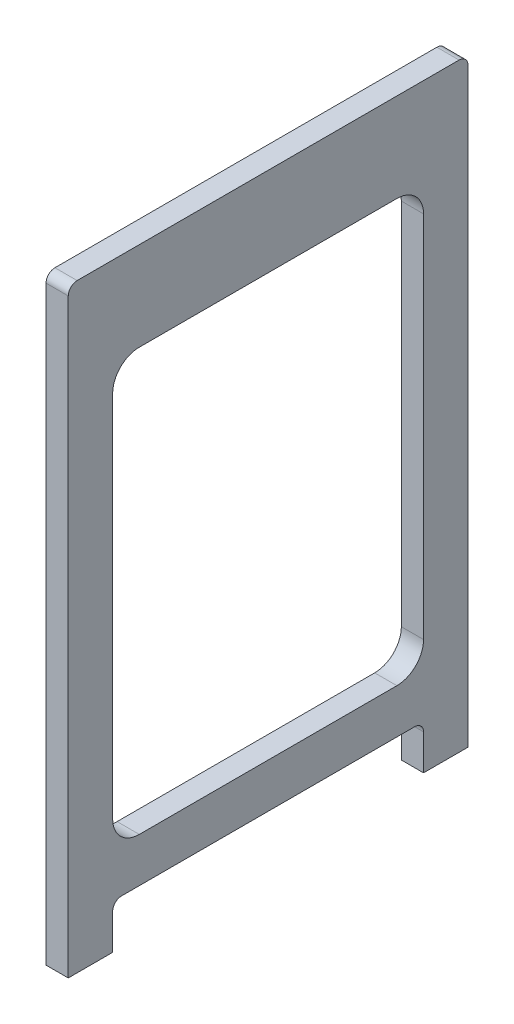
from build123d import *

# Parameters (mm, degrees)
SKETCH1_R           = 2.5
SKETCH1_W           = 350
SKETCH1_H           = 475
BOSS_EXTRUDE1_DEPTH = 12.5
BOSS_EXTRUDE2_START = -15
SKETCH2_R           = 2.5
BOSS_EXTRUDE2_DEPTH = 15
FILLET1_R           = 10
FILLET2_R           = 30
FILLET3_R           = 10


with BuildPart() as part:
    # Sketch1 → Boss-Extrude1 (new, symmetric)
    with BuildSketch(Plane(origin=(0, 0, 0), x_dir=(0, 0, -1), z_dir=(1, 0, 0))):
        Polygon((-175, -337.5), (-225, -337.5), (-225, 337.5), (225, 337.5), (225, -337.5), (175, -337.5), (175, -287.5), (-175, -287.5), align=None)
        with Locations((-150, 330)):
            Circle(SKETCH1_R, mode=Mode.SUBTRACT)
        with Locations((-110, 330)):
            Circle(SKETCH1_R, mode=Mode.SUBTRACT)
        with Locations((-130, 315)):
            Circle(SKETCH1_R, mode=Mode.SUBTRACT)
        with Locations(Location((110, 330, 0), (0, 0, 180))):
            Circle(SKETCH1_R, mode=Mode.SUBTRACT)
        with Locations(Location((150, 330, 0), (0, 0, 180))):
            Circle(SKETCH1_R, mode=Mode.SUBTRACT)
        with Locations(Location((130, 315, 0), (0, 0, 180))):
            Circle(SKETCH1_R, mode=Mode.SUBTRACT)
        Rectangle(SKETCH1_W, SKETCH1_H, mode=Mode.SUBTRACT)
    extrude(amount=BOSS_EXTRUDE1_DEPTH, both=True)

    # Sketch2 → Boss-Extrude2 (add)
    with BuildSketch(Plane(origin=(12.5, 0, 0), x_dir=(0, 0, -1), z_dir=(1, 0, 0)).offset(BOSS_EXTRUDE2_START)):
        with Locations((-110, 330)):
            Circle(SKETCH2_R)
        with Locations((-130, 315)):
            Circle(SKETCH2_R)
        with Locations((-150, 330)):
            Circle(SKETCH2_R)
        with Locations(Location((150, 330, 0), (0, 0, 180))):
            Circle(SKETCH2_R)
        with Locations(Location((130, 315, 0), (0, 0, 180))):
            Circle(SKETCH2_R)
        with Locations(Location((110, 330, 0), (0, 0, 180))):
            Circle(SKETCH2_R)
    extrude(amount=BOSS_EXTRUDE2_DEPTH)

    # Fillet1
    fillet1_edges = [part.edges().sort_by_distance(p)[0] for p in [
        (0, -287.5, -175),
        (0, -287.5, 175),
    ]]
    fillet(fillet1_edges, radius=FILLET1_R)

    # Fillet2
    fillet2_edges = [part.edges().sort_by_distance(p)[0] for p in [
        (0, 237.5, 175),
        (0, -237.5, 175),
        (0, -237.5, -175),
        (0, 237.5, -175),
    ]]
    fillet(fillet2_edges, radius=FILLET2_R)

    # Fillet3
    fillet3_edges = [part.edges().sort_by_distance(p)[0] for p in [
        (0, 337.5, 225),
        (0, 337.5, -225),
    ]]
    fillet(fillet3_edges, radius=FILLET3_R)


solid = part.part
